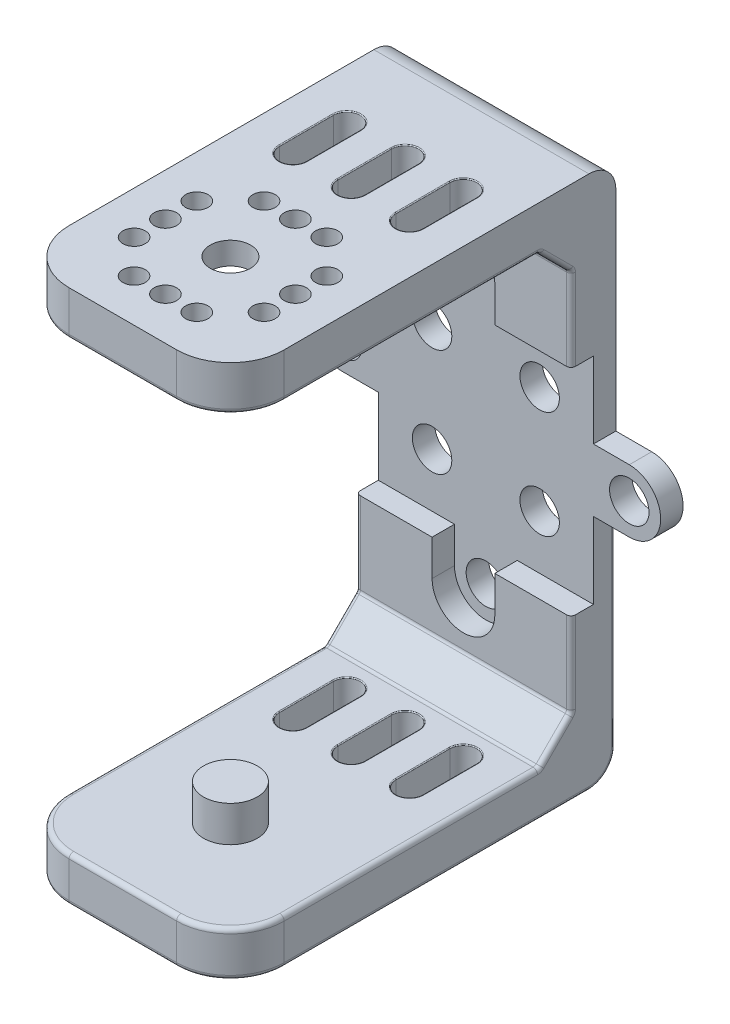
from build123d import *

# Parameters (mm, degrees)
BOSS_EXTRUDE1_DEPTH = 24
SKETCH2_R           = 10.5
CUT_EXTRUDE1_DEPTH  = 2.5
SKETCH4_R           = 2.25
SKETCH4_R_2         = 1.25
CUT_EXTRUDE2_DEPTH  = 10
FILLET2_R           = 6
FILLET3_R           = 3
CUT_EXTRUDE3_DEPTH  = 2.5
SKETCH10_R          = 2.2
CUT_EXTRUDE4_DEPTH  = 1000
SKETCH11_R          = 3
BOSS_EXTRUDE2_DEPTH = 4
CUT_EXTRUDE5_DEPTH  = 65
SKETCH14_R          = 2.2
BOSS_EXTRUDE3_DEPTH = 2.5
FILLET5_R           = 0.1
FILLET6_R           = 0.5


with BuildPart() as part:
    # Sketch1 → Boss-Extrude1 (new body)
    with BuildSketch(Plane(origin=(0, 0, 0), x_dir=(0, 0, -1), z_dir=(1, 0, 0))):
        Polygon((0, 59.7), (0, 0), (-43, 0), (-43, 5), (-8.535533906, 5), (-5, 8.535533906), (-5, 51.164466094), (-8.535533906, 54.7), (-43, 54.7), (-43, 59.7), align=None)
    extrude(amount=BOSS_EXTRUDE1_DEPTH)

    # Sketch2 → Cut-Extrude1 (cut)
    with BuildSketch(Plane.XZ.offset(-54.7)):
        with Locations(Location((12, 31, 0), (0, 0, 270))):
            Circle(SKETCH2_R)
    extrude(amount=-CUT_EXTRUDE1_DEPTH, mode=Mode.SUBTRACT)

    # Sketch4 → Cut-Extrude2 (cut)
    with BuildSketch(Plane.XZ.offset(-57.2)):
        with Locations(Location((12, 31, 0), (0, 0, 270))):
            Circle(SKETCH4_R)
        with Locations(Location((12, 38.25, 0), (0, 0, 270))):
            Circle(SKETCH4_R_2)
        with Locations(Location((8.5, 38.25, 0), (0, 0, 270))):
            Circle(SKETCH4_R_2)
        with Locations(Location((15.5, 38.25, 0), (0, 0, 270))):
            Circle(SKETCH4_R_2)
        with Locations(Location((19.25, 34.5, 0), (0, 0, 270))):
            Circle(SKETCH4_R_2)
        with Locations(Location((19.25, 31, 0), (0, 0, 270))):
            Circle(SKETCH4_R_2)
        with Locations(Location((19.25, 27.5, 0), (0, 0, 270))):
            Circle(SKETCH4_R_2)
        with Locations(Location((15.5, 23.75, 0), (0, 0, 270))):
            Circle(SKETCH4_R_2)
        with Locations(Location((12, 23.75, 0), (0, 0, 270))):
            Circle(SKETCH4_R_2)
        with Locations(Location((8.5, 23.75, 0), (0, 0, 270))):
            Circle(SKETCH4_R_2)
        with Locations(Location((4.75, 27.5, 0), (0, 0, 270))):
            Circle(SKETCH4_R_2)
        with Locations(Location((4.75, 31, 0), (0, 0, 270))):
            Circle(SKETCH4_R_2)
        with Locations(Location((4.75, 34.5, 0), (0, 0, 270))):
            Circle(SKETCH4_R_2)
    extrude(amount=-CUT_EXTRUDE2_DEPTH, mode=Mode.SUBTRACT)

    # Fillet2
    fillet2_edges = [part.edges().sort_by_distance(p)[0] for p in [
        (0, 2.5, 43),
        (0, 57.2, 43),
        (24, 2.5, 43),
        (24, 57.2, 43),
    ]]
    fillet(fillet2_edges, radius=FILLET2_R)

    # Fillet3
    fillet3_edges = [part.edges().sort_by_distance(p)[0] for p in [
        (12, 59.7, 0),
        (12, 0, 0),
    ]]
    fillet(fillet3_edges, radius=FILLET3_R)

    # Sketch9 → Cut-Extrude3 (cut)
    with BuildSketch(Plane.XY.offset(5)):
        with BuildLine():
            Line((0, 41.85), (8.5, 41.85))
            Line((8.5, 41.85), (8.5, 45.85))
            ThreePointArc((8.5, 45.85), (12, 49.35), (15.5, 45.85))
            Line((15.5, 45.85), (15.5, 41.85))
            Line((15.5, 41.85), (24, 41.85))
            Line((24, 41.85), (24, 17.85))
            Line((24, 17.85), (15.5, 17.85))
            Line((15.5, 17.85), (15.5, 13.85))
            ThreePointArc((15.5, 13.85), (12, 10.35), (8.5, 13.85))
            Line((8.5, 13.85), (8.5, 17.85))
            Line((8.5, 17.85), (0, 17.85))
            Line((0, 17.85), (0, 41.85))
        make_face()
    extrude(amount=-CUT_EXTRUDE3_DEPTH, mode=Mode.SUBTRACT)

    # Sketch10 → Cut-Extrude4 (cut)
    with BuildSketch(Plane.XY.offset(2.5)):
        with Locations((6, 35.85)):
            Circle(SKETCH10_R)
        with Locations((18, 35.85)):
            Circle(SKETCH10_R)
        with Locations((18, 23.85)):
            Circle(SKETCH10_R)
        with Locations((6, 23.85)):
            Circle(SKETCH10_R)
        with Locations((12, 45.85)):
            Circle(SKETCH10_R)
        with Locations(Location((12, 13.85, 0), (0, 0, 270))):
            Circle(SKETCH10_R)
    extrude(amount=-CUT_EXTRUDE4_DEPTH, mode=Mode.SUBTRACT)

    # Sketch11 → Boss-Extrude2 (add)
    with BuildSketch(Plane(origin=(0, 5, 0), x_dir=(1, 0, 0), z_dir=(0, 1, 0))):
        with Locations(Location((12, -31, 0), (0, 0, 90))):
            Circle(SKETCH11_R)
    extrude(amount=BOSS_EXTRUDE2_DEPTH)

    # Sketch12 → Cut-Extrude5 (cut, symmetric)
    with BuildSketch(Plane.XZ.offset(-54.7)):
        with BuildLine():
            Line((13.5, 11.517766953), (13.5, 17.517766953))
            ThreePointArc((13.5, 17.517766953), (12, 19.017766953), (10.5, 17.517766953))
            Line((10.5, 17.517766953), (10.5, 11.517766953))
            ThreePointArc((10.5, 11.517766953), (12, 10.017766953), (13.5, 11.517766953))
        make_face()
        with BuildLine():
            Line((20, 11.517766953), (20, 17.517766953))
            ThreePointArc((20, 17.517766953), (18.5, 19.017766953), (17, 17.517766953))
            Line((17, 17.517766953), (17, 11.517766953))
            ThreePointArc((17, 11.517766953), (18.5, 10.017766953), (20, 11.517766953))
        make_face()
        with BuildLine():
            Line((7, 11.517766953), (7, 17.517766953))
            ThreePointArc((7, 17.517766953), (5.5, 19.017766953), (4, 17.517766953))
            Line((4, 17.517766953), (4, 11.517766953))
            ThreePointArc((4, 11.517766953), (5.5, 10.017766953), (7, 11.517766953))
        make_face()
    extrude(amount=CUT_EXTRUDE5_DEPTH, both=True, mode=Mode.SUBTRACT)

    # Sketch14 → Boss-Extrude3 (add)
    # profile 1 of 2: a face of its own
    with BuildSketch(Plane(origin=(0, 0, 0), x_dir=(-1, 0, 0), z_dir=(0, 0, -1))):
        with BuildLine():
            Line((-24, 33.35), (-28, 33.35))
            ThreePointArc((-28, 33.35), (-31.5, 29.85), (-28, 26.35))
            Line((-28, 26.35), (-24, 26.35))
            Line((-24, 26.35), (-24, 33.35))
        make_face()
        with Locations(Location((-28, 29.85, 0), (0, 0, 90))):
            Circle(SKETCH14_R, mode=Mode.SUBTRACT)
    # profile 2 of 2: a face of its own
    with BuildSketch(Plane(origin=(0, 0, 0), x_dir=(-1, 0, 0), z_dir=(0, 0, -1))):
        with BuildLine():
            Line((0, 33.35), (4, 33.35))
            ThreePointArc((4, 33.35), (7.5, 29.85), (4, 26.35))
            Line((4, 26.35), (0, 26.35))
            Line((0, 26.35), (0, 33.35))
        make_face()
        with Locations((4, 29.85)):
            Circle(SKETCH14_R, mode=Mode.SUBTRACT)
    extrude(amount=-BOSS_EXTRUDE3_DEPTH)

    # Fillet5
    fillet5_edges = [part.edges().sort_by_distance(p)[0] for p in [
        (20, 0, 14.517766953),
        (18.5, 0, 19.017766953),
        (17, 0, 14.517766953),
        (18.5, 0, 10.017766953),
        (13.5, 0, 14.517766953),
        (12, 0, 19.017766953),
        (10.5, 0, 14.517766953),
        (12, 0, 10.017766953),
        (5.5, 0, 10.017766953),
        (7, 0, 14.517766953),
        (5.5, 0, 19.017766953),
        (4, 0, 14.517766953),
        (4, 59.7, 14.517766953),
        (4, 54.7, 14.517766953),
        (4, 5, 14.517766953),
        (5.5, 59.7, 19.017766953),
        (5.5, 54.7, 19.017766953),
        (5.5, 5, 19.017766953),
        (7, 59.7, 14.517766953),
        (7, 54.7, 14.517766953),
        (7, 5, 14.517766953),
        (5.5, 59.7, 10.017766953),
        (5.5, 54.7, 10.017766953),
        (5.5, 5, 10.017766953),
        (12, 59.7, 10.017766953),
        (12, 54.7, 10.017766953),
        (12, 5, 10.017766953),
        (10.5, 59.7, 14.517766953),
        (10.5, 54.7, 14.517766953),
        (10.5, 5, 14.517766953),
        (12, 59.7, 19.017766953),
        (12, 54.7, 19.017766953),
        (12, 5, 19.017766953),
        (13.5, 59.7, 14.517766953),
        (13.5, 54.7, 14.517766953),
        (13.5, 5, 14.517766953),
        (18.5, 59.7, 10.017766953),
        (18.5, 54.7, 10.017766953),
        (18.5, 5, 10.017766953),
        (17, 59.7, 14.517766953),
        (17, 54.7, 14.517766953),
        (17, 5, 14.517766953),
        (18.5, 59.7, 19.017766953),
        (18.5, 54.7, 19.017766953),
        (18.5, 5, 19.017766953),
        (20, 59.7, 14.517766953),
        (20, 54.7, 14.517766953),
        (20, 5, 14.517766953),
    ]]
    fillet(fillet5_edges, radius=FILLET5_R)

    # Fillet6
    fillet6_edges = [part.edges().sort_by_distance(p)[0] for p in [
        (24, 54.7, 22.767766953),
        (24, 0, 20),
        (0, 0, 20),
        (12, 0, 43),
        (1.757359313, 0, 41.242640687),
        (22.242640687, 0, 41.242640687),
        (12, 5, 43),
        (1.757359313, 5, 41.242640687),
        (22.242640687, 5, 41.242640687),
        (0, 54.7, 22.767766953),
        (12, 54.7, 43),
        (1.757359313, 54.7, 41.242640687),
        (22.242640687, 54.7, 41.242640687),
        (0, 5, 22.767766953),
        (0, 6.767766953, 6.767766953),
        (0, 46.507233047, 5),
        (0, 52.932233047, 6.767766953),
        (0, 14.675, 0),
        (24, 14.675, 0),
        (0, 0.878679656, 0.878679656),
        (24, 0.878679656, 0.878679656),
        (0, 13.192766953, 5),
        (24, 13.192766953, 5),
        (24, 52.932233047, 6.767766953),
        (12, 5, 8.535533906),
        (12, 8.535533906, 5),
        (12, 51.164466094, 5),
        (12, 54.7, 8.535533906),
        (24, 46.507233047, 5),
        (24, 6.767766953, 6.767766953),
        (24, 5, 22.767766953),
    ]]
    fillet(fillet6_edges, radius=FILLET6_R)


solid = part.part
